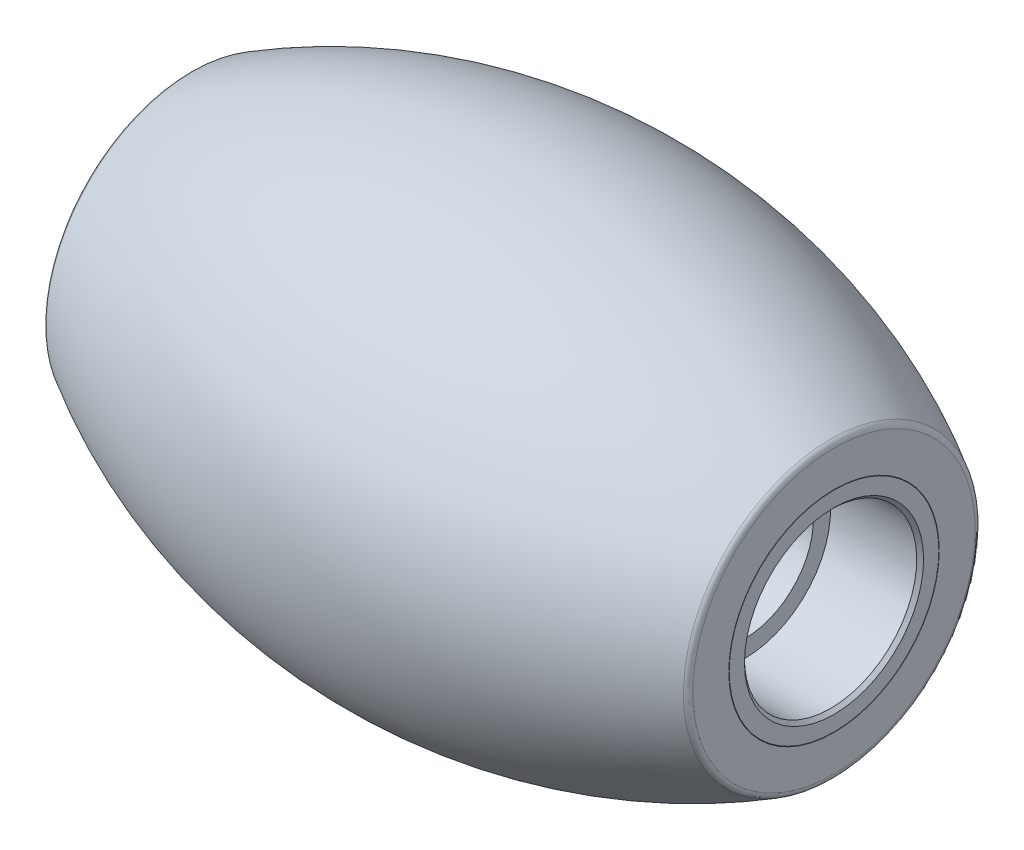
from build123d import *

# Parameters (mm, degrees)
CHANFREIN1_SIZE = 0.1
CONG_1_R        = 0.2


with BuildPart() as part:
    # Esquisse1 → Révolution1 (revolve)
    with BuildSketch(Plane.XY, mode=Mode.PRIVATE) as r_volution1_sk:
        with BuildLine():
            Line((9.35, 0), (9.35, 3.042819204))
            ThreePointArc((9.35, 3.042819204), (0, 5.75), (-9.35, 3.042819204))
            Line((-9.35, 3.042819204), (-9.35, 0))
            Line((-9.35, 0), (9.35, 0))
        make_face()
    revolve(r_volution1_sk.sketch.rotate(Axis((-9.35, 0, 0), (1, 0, 0)), 180), axis=Axis((-9.35, 0, 0), (1, 0, 0)))

    # Esquisse2 → Enlèvement de matière-Révolution1 (revolve, cut)
    with BuildSketch(Plane.XY, mode=Mode.PRIVATE) as enl_vement_de_mati_re_r_volution1_sk:
        Polygon((-9.35, 2.5), (-6.75, 2.5), (-6.75, 2), (6.75, 2), (6.75, 2.5), (9.35, 2.5), (9.35, 0), (-9.35, 0), align=None)
    revolve(enl_vement_de_mati_re_r_volution1_sk.sketch.rotate(Axis((-9.35, 0, 0), (1, 0, 0)), 180), axis=Axis((-9.35, 0, 0), (1, 0, 0)), mode=Mode.SUBTRACT)

    # Chanfrein1
    chanfrein1_edges = [part.edges().sort_by_distance(p)[0] for p in [
        (-9.35, 2.5, 0),
        (9.35, 2.5, 0),
    ]]
    chamfer(chanfrein1_edges, length=CHANFREIN1_SIZE)


with BuildPart() as body_2:
    # Esquisse4 → Révolution2 (revolve)
    with BuildSketch(Plane.XY, mode=Mode.PRIVATE) as r_volution2_sk:
        with BuildLine():
            Line((-9.35, 3.054647919), (-9.35, 4.213317324))
            ThreePointArc((-9.35, 4.213317324), (0, 6.75), (9.35, 4.213317324))
            Line((9.35, 4.213317324), (9.35, 3.054647919))
            ThreePointArc((9.35, 3.054647919), (0, 5.76), (-9.35, 3.054647919))
        make_face()
    revolve(r_volution2_sk.sketch.rotate(Axis((-9.35, 0, 0), (1, 0, 0)), 180), axis=Axis((-9.35, 0, 0), (1, 0, 0)))

    # Congé1
    cong_1_edges = [body_2.edges().sort_by_distance(p)[0] for p in [
        (-9.35, 4.213317324, 0),
        (9.35, 4.213317324, 0),
    ]]
    fillet(cong_1_edges, radius=CONG_1_R)


solid = Compound([part.part, body_2.part])
